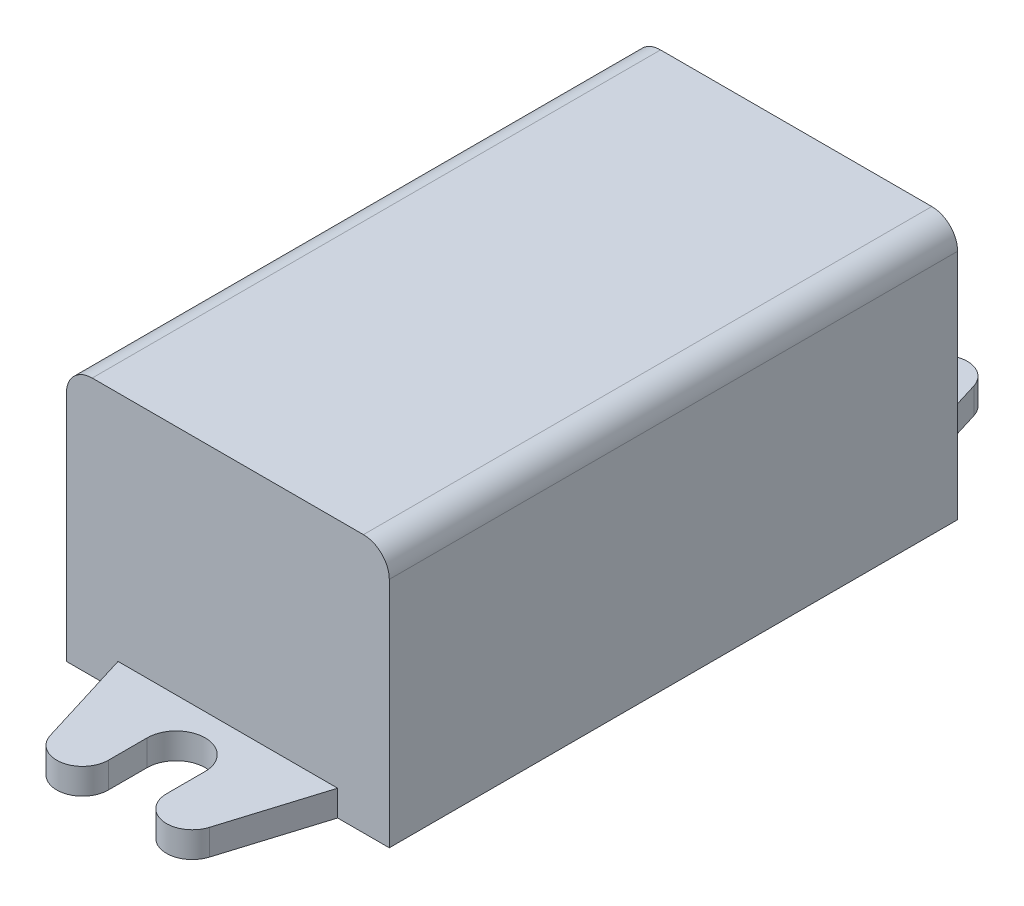
from build123d import *

# Parameters (mm, degrees)
SKETCH_1_W      = 25
SKETCH_1_H      = 20
EXTRUDE_1_DEPTH = 22
EXTRUDE_2_DEPTH = 2
FILLET_1_R      = 2


with BuildPart() as part:
    # 草图1 → 凸台-拉伸1 (new, symmetric)
    with BuildSketch(Plane.XY):
        Rectangle(SKETCH_1_W, SKETCH_1_H)
    extrude(amount=EXTRUDE_1_DEPTH, both=True)

    # 草图2 → 凸台-拉伸2 (add)
    with BuildSketch(Plane.XZ.offset(10)):
        with BuildLine():
            Line((-8.5, -22), (-6.161301565, -29.589004522))
            ThreePointArc((-6.161301565, -29.589004522), (-3.952177176, -30.977701081), (-2.25, -29))
            Line((-2.25, -29), (-2.25, -26))
            ThreePointArc((-2.25, -26), (0, -23.75), (2.25, -26))
            Line((2.25, -26), (2.25, -29))
            ThreePointArc((2.25, -29), (3.952177176, -30.977701081), (6.161301565, -29.589004522))
            Line((6.161301565, -29.589004522), (8.5, -22))
            Line((8.5, -22), (-8.5, -22))
        make_face()
        with BuildLine():
            Line((-8.5, 22), (8.5, 22))
            Line((8.5, 22), (6.161301565, 29.589004522))
            ThreePointArc((6.161301565, 29.589004522), (3.952177176, 30.977701081), (2.25, 29))
            Line((2.25, 29), (2.25, 26))
            ThreePointArc((2.25, 26), (0, 23.75), (-2.25, 26))
            Line((-2.25, 26), (-2.25, 29))
            ThreePointArc((-2.25, 29), (-3.952177176, 30.977701081), (-6.161301565, 29.589004522))
            Line((-6.161301565, 29.589004522), (-8.5, 22))
        make_face()
    extrude(amount=-EXTRUDE_2_DEPTH)

    # 圆角1
    fillet_1_edges = [part.edges().sort_by_distance(p)[0] for p in [
        (-12.5, 10, 0),
        (12.5, 10, 0),
    ]]
    fillet(fillet_1_edges, radius=FILLET_1_R)


solid = part.part
